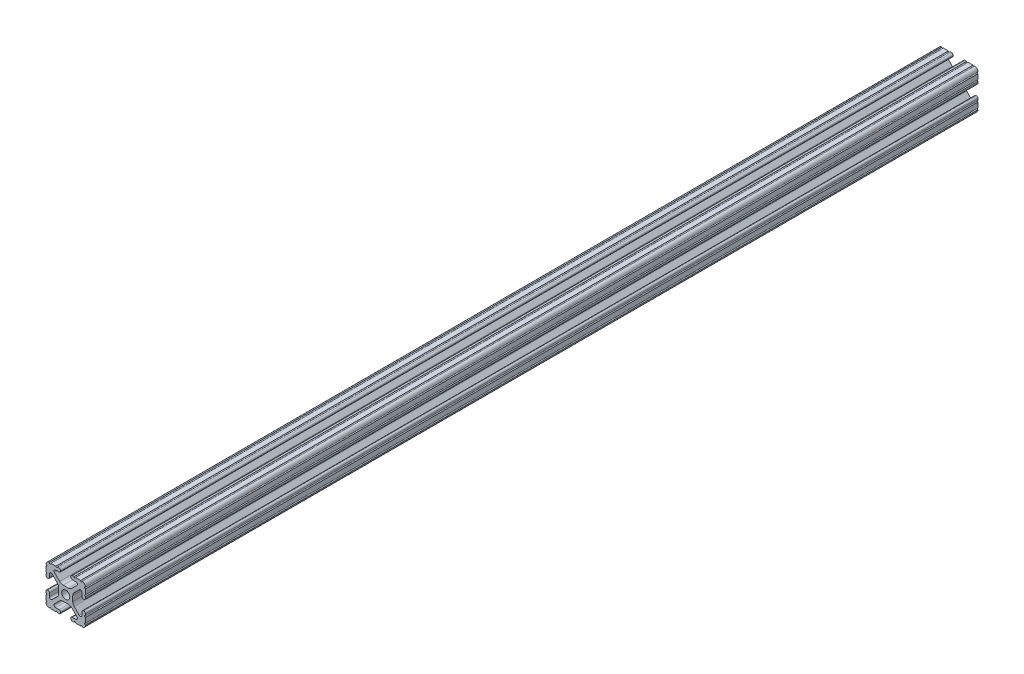
from build123d import *

# Parameters (mm, degrees)
SKETCH1_R           = 2.6035
BOSS_EXTRUDE1_DEPTH = 287.4


with BuildPart() as part:
    # Sketch1 → Boss-Extrude1 (new, symmetric)
    with BuildSketch(Plane.XY):
        with BuildLine():
            Line((-7.179650497, -8.645192506), (-3.952270251, -5.423690499))
            ThreePointArc((-3.952270251, -5.423690499), (-2.922936451, -4.736929036), (-1.709253557, -4.4958))
            Line((-1.709253557, -4.4958), (1.709253557, -4.4958))
            ThreePointArc((1.709253557, -4.4958), (2.922936451, -4.736929036), (3.952270251, -5.423690499))
            Line((3.952270251, -5.423690499), (7.179650497, -8.645192506))
            ThreePointArc((7.179650497, -8.645192506), (7.41473083, -9.822813117), (6.416408329, -10.4902))
            Line((6.416408329, -10.4902), (4.287512407, -10.4902))
            ThreePointArc((4.287512407, -10.4902), (3.54574862, -10.79744862), (3.2385, -11.539212407))
            Line((3.2385, -11.539212407), (3.2385, -11.650987593))
            ThreePointArc((3.2385, -11.650987593), (3.54574862, -12.39275138), (4.287512407, -12.7))
            Line((4.287512407, -12.7), (5.317126718, -12.7))
            ThreePointArc((5.317126718, -12.7), (5.825126718, -12.192), (6.333126718, -12.7))
            Line((6.333126718, -12.7), (9.550443118, -12.7))
            ThreePointArc((9.550443118, -12.7), (10.058366869, -12.192000006), (10.566443095, -12.699847501))
            ThreePointArc((10.566443095, -12.699847501), (12.082537762, -12.08250727), (12.699846982, -10.566399977))
            ThreePointArc((12.699846982, -10.566399977), (12.192000006, -10.058323491), (12.7, -9.5504))
            Line((12.7, -9.5504), (12.7, -6.3330836))
            ThreePointArc((12.7, -6.3330836), (12.192, -5.8250836), (12.7, -5.3170836))
            Line((12.7, -5.3170836), (12.7, -4.287469289))
            ThreePointArc((12.7, -4.287469289), (12.39275138, -3.545705502), (11.650987593, -3.238456882))
            Line((11.650987593, -3.238456882), (11.539212407, -3.238456882))
            ThreePointArc((11.539212407, -3.238456882), (10.79744862, -3.545705502), (10.4902, -4.287469289))
            Line((10.4902, -4.287469289), (10.4902, -6.402089023))
            ThreePointArc((10.4902, -6.402089023), (9.856505071, -7.351067942), (8.737131347, -7.129408934))
            Line((8.737131347, -7.129408934), (5.441005833, -3.840816462))
            ThreePointArc((5.441005833, -3.840816462), (4.750877967, -2.809883091), (4.5085, -1.593185507))
            Line((4.5085, -1.593185507), (4.5085, 1.593185507))
            ThreePointArc((4.5085, 1.593185507), (4.750877967, 2.809883091), (5.441005833, 3.840816462))
            Line((5.441005833, 3.840816462), (8.737131347, 7.129408934))
            ThreePointArc((8.737131347, 7.129408934), (9.856505071, 7.351067942), (10.4902, 6.402089023))
            Line((10.4902, 6.402089023), (10.4902, 4.287469289))
            ThreePointArc((10.4902, 4.287469289), (10.79744862, 3.545705502), (11.539212407, 3.238456882))
            Line((11.539212407, 3.238456882), (11.650987593, 3.238456882))
            ThreePointArc((11.650987593, 3.238456882), (12.39275138, 3.545705502), (12.7, 4.287469289))
            Line((12.7, 4.287469289), (12.7, 5.3170836))
            ThreePointArc((12.7, 5.3170836), (12.192, 5.8250836), (12.7, 6.3330836))
            Line((12.7, 6.3330836), (12.7, 9.5504))
            ThreePointArc((12.7, 9.5504), (12.192000006, 10.058323491), (12.699846982, 10.566399977))
            ThreePointArc((12.699846982, 10.566399977), (12.082537762, 12.08250727), (10.566443095, 12.699847501))
            ThreePointArc((10.566443095, 12.699847501), (10.058366869, 12.192000006), (9.550443118, 12.7))
            Line((9.550443118, 12.7), (6.333126718, 12.7))
            ThreePointArc((6.333126718, 12.7), (5.825126718, 12.192), (5.317126718, 12.7))
            Line((5.317126718, 12.7), (4.287512407, 12.7))
            ThreePointArc((4.287512407, 12.7), (3.54574862, 12.39275138), (3.2385, 11.650987593))
            Line((3.2385, 11.650987593), (3.2385, 11.539212407))
            ThreePointArc((3.2385, 11.539212407), (3.54574862, 10.79744862), (4.287512407, 10.4902))
            Line((4.287512407, 10.4902), (6.476788598, 10.4902))
            ThreePointArc((6.476788598, 10.4902), (7.432222385, 9.85140422), (7.207036008, 8.724370562))
            Line((7.207036008, 8.724370562), (3.898272566, 5.423169045))
            ThreePointArc((3.898272566, 5.423169045), (2.869120213, 4.736787962), (1.655778399, 4.4958))
            Line((1.655778399, 4.4958), (-1.655778399, 4.4958))
            ThreePointArc((-1.655778399, 4.4958), (-2.869120213, 4.736787962), (-3.898272566, 5.423169045))
            Line((-3.898272566, 5.423169045), (-7.207036008, 8.724370562))
            ThreePointArc((-7.207036008, 8.724370562), (-7.432222385, 9.85140422), (-6.476788598, 10.4902))
            Line((-6.476788598, 10.4902), (-4.287512407, 10.4902))
            ThreePointArc((-4.287512407, 10.4902), (-3.54574862, 10.79744862), (-3.2385, 11.539212407))
            Line((-3.2385, 11.539212407), (-3.2385, 11.650987593))
            ThreePointArc((-3.2385, 11.650987593), (-3.54574862, 12.39275138), (-4.287512407, 12.7))
            Line((-4.287512407, 12.7), (-5.317126718, 12.7))
            ThreePointArc((-5.317126718, 12.7), (-5.825126718, 12.192), (-6.333126718, 12.7))
            Line((-6.333126718, 12.7), (-9.550443118, 12.7))
            ThreePointArc((-9.550443118, 12.7), (-10.058366869, 12.192000006), (-10.566443095, 12.699847501))
            ThreePointArc((-10.566443095, 12.699847501), (-12.082537762, 12.08250727), (-12.699846982, 10.566399977))
            ThreePointArc((-12.699846982, 10.566399977), (-12.192000006, 10.058323491), (-12.7, 9.5504))
            Line((-12.7, 9.5504), (-12.7, 6.3330836))
            ThreePointArc((-12.7, 6.3330836), (-12.192, 5.8250836), (-12.7, 5.3170836))
            Line((-12.7, 5.3170836), (-12.7, 4.287469289))
            ThreePointArc((-12.7, 4.287469289), (-12.39275138, 3.545705502), (-11.650987593, 3.238456882))
            Line((-11.650987593, 3.238456882), (-11.539212407, 3.238456882))
            ThreePointArc((-11.539212407, 3.238456882), (-10.79744862, 3.545705502), (-10.4902, 4.287469289))
            Line((-10.4902, 4.287469289), (-10.4902, 6.402089023))
            ThreePointArc((-10.4902, 6.402089023), (-9.856505071, 7.351067942), (-8.737131347, 7.129408934))
            Line((-8.737131347, 7.129408934), (-5.441005833, 3.840816462))
            ThreePointArc((-5.441005833, 3.840816462), (-4.750877967, 2.809883091), (-4.5085, 1.593185507))
            Line((-4.5085, 1.593185507), (-4.5085, -1.593185507))
            ThreePointArc((-4.5085, -1.593185507), (-4.750877967, -2.809883091), (-5.441005833, -3.840816462))
            Line((-5.441005833, -3.840816462), (-8.737131347, -7.129408934))
            ThreePointArc((-8.737131347, -7.129408934), (-9.856505071, -7.351067942), (-10.4902, -6.402089023))
            Line((-10.4902, -6.402089023), (-10.4902, -4.287469289))
            ThreePointArc((-10.4902, -4.287469289), (-10.79744862, -3.545705502), (-11.539212407, -3.238456882))
            Line((-11.539212407, -3.238456882), (-11.650987593, -3.238456882))
            ThreePointArc((-11.650987593, -3.238456882), (-12.39275138, -3.545705502), (-12.7, -4.287469289))
            Line((-12.7, -4.287469289), (-12.7, -5.3170836))
            ThreePointArc((-12.7, -5.3170836), (-12.192, -5.8250836), (-12.7, -6.3330836))
            Line((-12.7, -6.3330836), (-12.7, -9.5504))
            ThreePointArc((-12.7, -9.5504), (-12.192000006, -10.058323491), (-12.699846982, -10.566399977))
            ThreePointArc((-12.699846982, -10.566399977), (-12.082537762, -12.08250727), (-10.566443095, -12.699847501))
            ThreePointArc((-10.566443095, -12.699847501), (-10.058366869, -12.192000006), (-9.550443118, -12.7))
            Line((-9.550443118, -12.7), (-6.333126718, -12.7))
            ThreePointArc((-6.333126718, -12.7), (-5.825126718, -12.192), (-5.317126718, -12.7))
            Line((-5.317126718, -12.7), (-4.287512407, -12.7))
            ThreePointArc((-4.287512407, -12.7), (-3.54574862, -12.39275138), (-3.2385, -11.650987593))
            Line((-3.2385, -11.650987593), (-3.2385, -11.539212407))
            ThreePointArc((-3.2385, -11.539212407), (-3.54574862, -10.79744862), (-4.287512407, -10.4902))
            Line((-4.287512407, -10.4902), (-6.416408329, -10.4902))
            ThreePointArc((-6.416408329, -10.4902), (-7.41473083, -9.822813117), (-7.179650497, -8.645192506))
        make_face()
        Circle(SKETCH1_R, mode=Mode.SUBTRACT)
    extrude(amount=BOSS_EXTRUDE1_DEPTH, both=True)


solid = part.part
